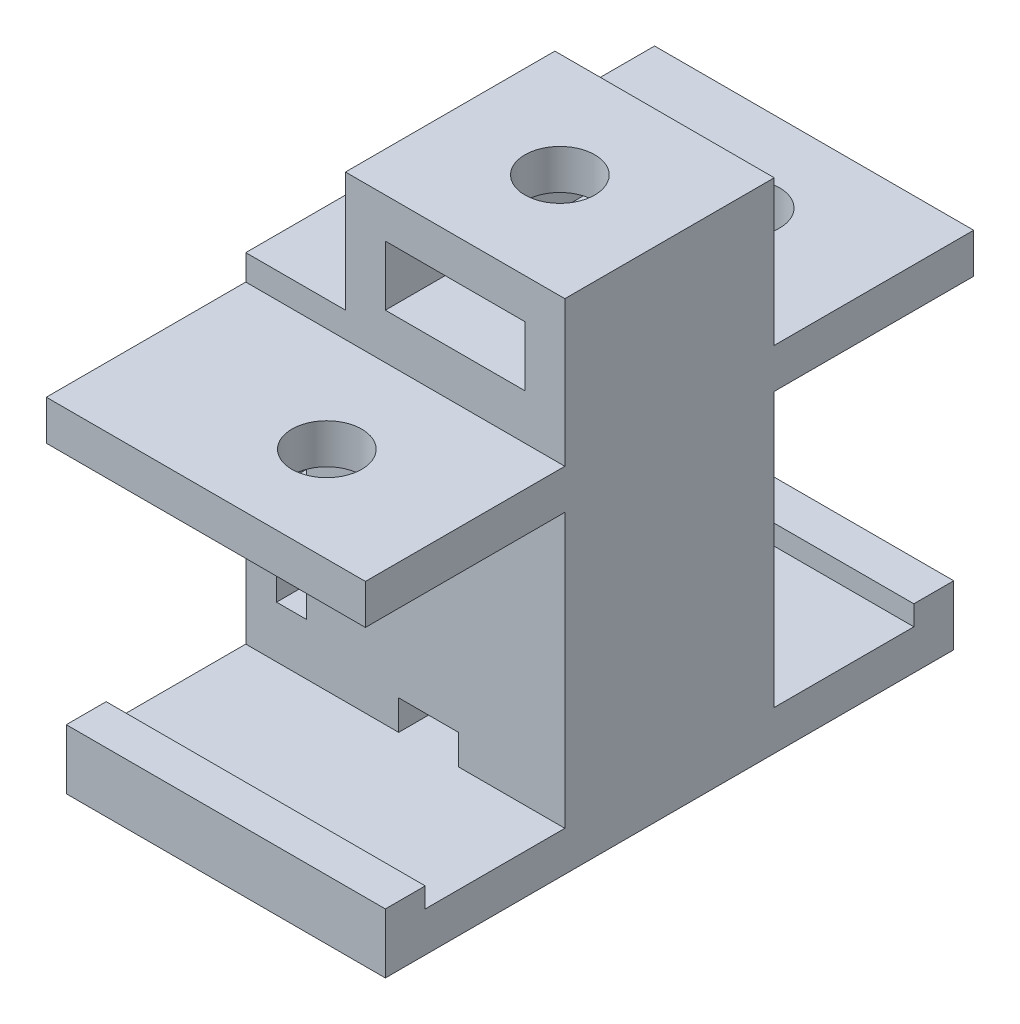
from build123d import *

# Parameters (mm, degrees)
SKETCH1_W           = 16
SKETCH1_H           = 10.5
BOSS_EXTRUDE1_DEPTH = 25
SKETCH3_W           = 16
SKETCH3_H           = 2
BOSS_EXTRUDE2_DEPTH = 7
BOSS_EXTRUDE5_START = -10.5
SKETCH3_2_W         = 16
SKETCH3_2_H         = 2
BOSS_EXTRUDE5_DEPTH = 7
SKETCH2_W           = 3
SKETCH2_H           = 1.5
SKETCH2_W_2         = 1.5
SKETCH2_H_2         = 2
CUT_EXTRUDE1_DEPTH  = 20
SKETCH5_W           = 16
SKETCH5_H           = 2
BOSS_EXTRUDE3_DEPTH = 3
BOSS_EXTRUDE6_START = -24.5
SKETCH5_2_W         = 16
SKETCH5_2_H         = 2
BOSS_EXTRUDE6_DEPTH = 3
SKETCH4_R           = 1.75
CUT_EXTRUDE2_DEPTH  = 10
SKETCH6_W           = 16
SKETCH6_H           = 3
BOSS_EXTRUDE4_DEPTH = 2
BOSS_EXTRUDE7_START = -24.5
SKETCH6_2_W         = 16
SKETCH6_2_H         = 3
BOSS_EXTRUDE7_DEPTH = 2
SKETCH7_W           = 10.5
SKETCH7_H           = 6
CUT_EXTRUDE3_DEPTH  = 5
SKETCH8_R           = 1.75
CUT_EXTRUDE4_DEPTH  = 5
SKETCH10_W          = 7
SKETCH10_H          = 3
CUT_EXTRUDE5_DEPTH  = 15


with BuildPart() as part:
    # Sketch1 → Boss-Extrude1 (new body)
    with BuildSketch(Plane(origin=(0, 0, 0), x_dir=(1, 0, 0), z_dir=(0, 1, 0))):
        with Locations((8, 5.25)):
            Rectangle(SKETCH1_W, SKETCH1_H)
    extrude(amount=BOSS_EXTRUDE1_DEPTH)

    # Sketch3 → Boss-Extrude2 (add)
    with BuildSketch(Plane.XY):
        with Locations((8, 1)):
            Rectangle(SKETCH3_W, SKETCH3_H)
        with Locations((8, 16.721705876)):
            Rectangle(SKETCH3_W, SKETCH3_H)
    extrude(amount=BOSS_EXTRUDE2_DEPTH)

    # Sketch3<2> → Boss-Extrude5 (add)
    with BuildSketch(Plane.XY.offset(BOSS_EXTRUDE5_START)):
        with Locations((8, 1)):
            Rectangle(SKETCH3_2_W, SKETCH3_2_H)
        with Locations((8, 16.721705876)):
            Rectangle(SKETCH3_2_W, SKETCH3_2_H)
    extrude(amount=-BOSS_EXTRUDE5_DEPTH)

    # Sketch2 → Cut-Extrude1 (cut)
    with BuildSketch(Plane.XY):
        with Locations((9.168058596, 2.75)):
            Rectangle(SKETCH2_W, SKETCH2_H)
        with Locations((9.127915422, 14.553433745)):
            Rectangle(SKETCH2_W, SKETCH2_H)
        with Locations((2.294862544, 5.592632304)):
            Rectangle(SKETCH2_W_2, SKETCH2_H_2)
        with Locations((2.294862544, 10.60615461)):
            Rectangle(SKETCH2_W_2, SKETCH2_H_2)
    extrude(amount=-CUT_EXTRUDE1_DEPTH, mode=Mode.SUBTRACT)

    # Sketch5 → Boss-Extrude3 (add)
    with BuildSketch(Plane.XY.offset(7)):
        with Locations((8, 16.721705876)):
            Rectangle(SKETCH5_W, SKETCH5_H)
    extrude(amount=BOSS_EXTRUDE3_DEPTH)

    # Sketch5<2> → Boss-Extrude6 (add)
    with BuildSketch(Plane.XY.offset(7).offset(BOSS_EXTRUDE6_START)):
        with Locations((8, 16.721705876)):
            Rectangle(SKETCH5_2_W, SKETCH5_2_H)
    extrude(amount=-BOSS_EXTRUDE6_DEPTH)

    # Sketch4 → Cut-Extrude2 (cut)
    with BuildSketch(Plane(origin=(0, 17.721705876, 0), x_dir=(1, 0, 0), z_dir=(0, 1, 0))):
        with Locations(Location((9.291269906, -5.227094259, 0), (0, 0, 270))):
            Circle(SKETCH4_R)
        with Locations(Location((9.291269906, 15.727094259, 0), (0, 0, 90))):
            Circle(SKETCH4_R)
    extrude(amount=-CUT_EXTRUDE2_DEPTH, mode=Mode.SUBTRACT)

    # Sketch6 → Boss-Extrude4 (add)
    with BuildSketch(Plane.XY.offset(7)):
        with Locations((8, 1.5)):
            Rectangle(SKETCH6_W, SKETCH6_H)
    extrude(amount=BOSS_EXTRUDE4_DEPTH)

    # Sketch6<2> → Boss-Extrude7 (add)
    with BuildSketch(Plane.XY.offset(7).offset(BOSS_EXTRUDE7_START)):
        with Locations((8, 1.5)):
            Rectangle(SKETCH6_2_W, SKETCH6_2_H)
    extrude(amount=-BOSS_EXTRUDE7_DEPTH)

    # Sketch7 → Cut-Extrude3 (cut)
    with BuildSketch(Plane.ZY):
        with Locations((-5.25, 22)):
            Rectangle(SKETCH7_W, SKETCH7_H)
    extrude(amount=-CUT_EXTRUDE3_DEPTH, mode=Mode.SUBTRACT)

    # Sketch8 → Cut-Extrude4 (cut)
    with BuildSketch(Plane(origin=(0, 25, 0), x_dir=(1, 0, 0), z_dir=(0, 1, 0))):
        with Locations(Location((10.5, 5.25, 0), (0, 0, 270))):
            Circle(SKETCH8_R)
    extrude(amount=-CUT_EXTRUDE4_DEPTH, mode=Mode.SUBTRACT)

    # Sketch10 → Cut-Extrude5 (cut)
    with BuildSketch(Plane.XY):
        with Locations((10.5, 21.5)):
            Rectangle(SKETCH10_W, SKETCH10_H)
    extrude(amount=-CUT_EXTRUDE5_DEPTH, mode=Mode.SUBTRACT)


solid = part.part
